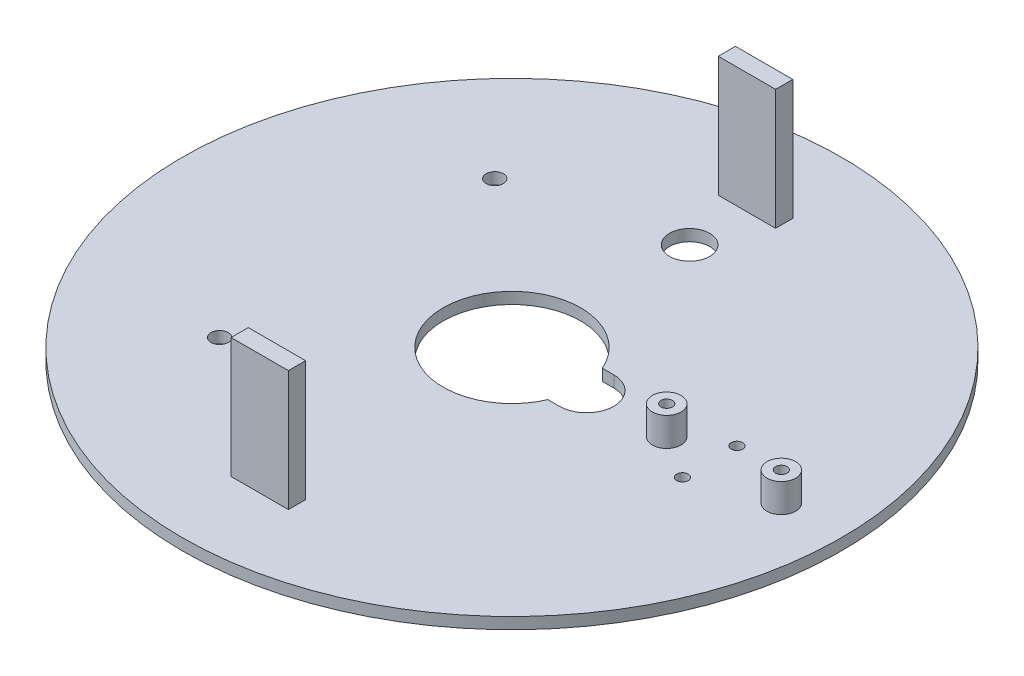
from build123d import *

# Parameters (mm, degrees)
ESQUISSE1_R                  = 57.5
BOSS_EXTRU_1_DEPTH           = 2
ESQUISSE2_R                  = 12
ENL_V_MAT_EXTRU_1_DEPTH      = 3
ESQUISSE5_W                  = 10
ESQUISSE5_H                  = 3
BOSS_EXTRU_3_DEPTH           = 21
ESQUISSE8_R                  = 2.5
ESQUISSE8_R_2                = 1
BOSS_EXTRU_4_DEPTH           = 5
ESQUISSE11_R                 = 3.5
ENL_V_MAT_EXTRU_7_DEPTH      = 84.985117729
ENL_V_MAT_EXTRU_8_DEPTH      = 84.985117729
ENL_V_MAT_EXTRU_8_DEPTH_BACK = 84.985117729
ESQUISSE12_R                 = 1.5
ESQUISSE14_R                 = 1
ENL_V_MAT_EXTRU_10_DEPTH     = 84.985117729


with BuildPart() as part:
    # Esquisse1 → Boss.-Extru.1 (new body)
    with BuildSketch(Plane(origin=(0, 0, 0), x_dir=(1, 0, 0), z_dir=(0, 1, 0))):
        with Locations(Location((0, 0, 0), (0, 0, 270))):
            Circle(ESQUISSE1_R)
    extrude(amount=BOSS_EXTRU_1_DEPTH)

    # Esquisse2 → Enlèv. mat.-Extru.1 (cut)
    with BuildSketch(Plane(origin=(0, 2, 0), x_dir=(1, 0, 0), z_dir=(0, 1, 0))):
        with Locations(Location((0, 0, 0), (0, 0, 270))):
            Circle(ESQUISSE2_R)
    extrude(amount=-ENL_V_MAT_EXTRU_1_DEPTH, mode=Mode.SUBTRACT)

    # Esquisse5 → Boss.-Extru.3 (add)
    with BuildSketch(Plane(origin=(0, 2, 0), x_dir=(1, 0, 0), z_dir=(0, 1, 0))):
        with Locations((0, -42.5)):
            Rectangle(ESQUISSE5_W, ESQUISSE5_H)
        with Locations((0, 42.5)):
            Rectangle(ESQUISSE5_W, ESQUISSE5_H)
    extrude(amount=BOSS_EXTRU_3_DEPTH)

    # Esquisse8 → Boss.-Extru.4 (add)
    # profile 1 of 2: a face of its own
    with BuildSketch(Plane(origin=(0, 2, 0), x_dir=(1, 0, 0), z_dir=(0, 1, 0))):
        with Locations(Location((27, 0, 0), (0, 0, 270))):
            Circle(ESQUISSE8_R)
        with Locations(Location((27, 0, 0), (0, 0, 270))):
            Circle(ESQUISSE8_R_2, mode=Mode.SUBTRACT)
    # profile 2 of 2: a face of its own
    with BuildSketch(Plane(origin=(0, 2, 0), x_dir=(1, 0, 0), z_dir=(0, 1, 0))):
        with Locations(Location((47, 0, 0), (0, 0, 270))):
            Circle(ESQUISSE8_R)
        with Locations(Location((47, 0, 0), (0, 0, 270))):
            Circle(ESQUISSE8_R_2, mode=Mode.SUBTRACT)
    extrude(amount=BOSS_EXTRU_4_DEPTH)

    # Esquisse11 → Enlèv. mat.-Extru.7 (cut, through all)
    with BuildSketch(Plane(origin=(0, 2, 0), x_dir=(1, 0, 0), z_dir=(0, 1, 0))):
        with Locations(Location((0, 31, 0), (0, 0, 270))):
            Circle(ESQUISSE11_R)
    extrude(amount=-ENL_V_MAT_EXTRU_7_DEPTH, mode=Mode.SUBTRACT)

    # Esquisse12 → Enlèv. mat.-Extru.8 (cut, two sides: drawn at the far end of the back side and taken through both)
    with BuildSketch(Plane(origin=(0, 2, 0), x_dir=(1, 0, 0), z_dir=(0, 1, 0)).offset(-ENL_V_MAT_EXTRU_8_DEPTH_BACK)):
        with Locations(Location((-27, 24, 0), (0, 0, 270))):
            Circle(ESQUISSE12_R)
        with Locations(Location((-27, -24, 0), (0, 0, 270))):
            Circle(ESQUISSE12_R)
    extrude(amount=ENL_V_MAT_EXTRU_8_DEPTH + ENL_V_MAT_EXTRU_8_DEPTH_BACK, mode=Mode.SUBTRACT)

    # Esquisse14 → Enlèv. mat.-Extru.10 (cut, through all)
    with BuildSketch(Plane(origin=(0, 2, 0), x_dir=(1, 0, 0), z_dir=(0, 1, 0))):
        with Locations(Location((34.5, -4.75, 0), (0, 0, 270))):
            Circle(ESQUISSE14_R)
        with Locations(Location((34.5, 4.75, 0), (0, 0, 270))):
            Circle(ESQUISSE14_R)
        with BuildLine():
            Line((11.01986842, -4.75), (13.01986842, -4.75))
            ThreePointArc((13.01986842, -4.75), (17.76986842, 0), (13.01986842, 4.75))
            Line((13.01986842, 4.75), (11.01986842, 4.75))
            Line((11.01986842, 4.75), (11.01986842, -4.75))
        make_face()
    extrude(amount=-ENL_V_MAT_EXTRU_10_DEPTH, mode=Mode.SUBTRACT)


solid = part.part
